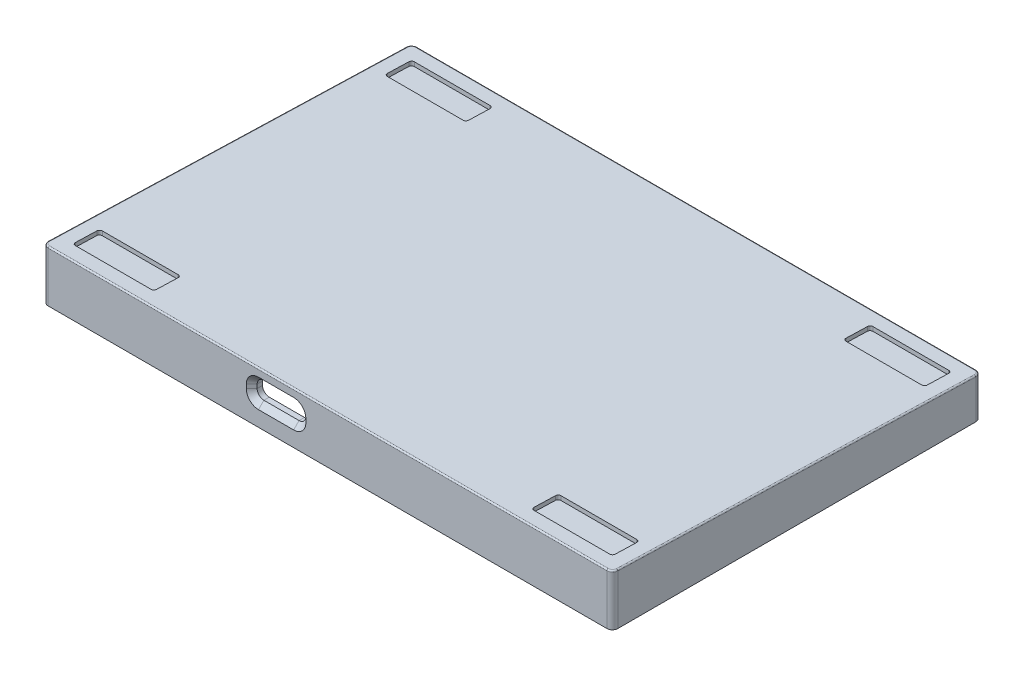
from build123d import *

# Parameters (mm, degrees)
SKETCH1_W           = 105.25
SKETCH1_H           = 68.15
SKETCH1_W_2         = 101.25
SKETCH1_H_2         = 64.15
BOSS_EXTRUDE1_DEPTH = 7.5
CUT_EXTRUDE1_DEPTH  = 125.009414965
BOSS_EXTRUDE5_DEPTH = 105.25
CUT_EXTRUDE2_REACH  = 125.247
CHAMFER1_SIZE       = 1
SKETCH13_RX         = 2.5
SKETCH13_RY         = 2.498833977
BOSS_EXTRUDE7_DEPTH = 10
SKETCH14_W          = 64.15
SKETCH14_H          = 10
CUT_EXTRUDE3_DEPTH  = 45
SKETCH15_R          = 1.5
CUT_EXTRUDE4_DEPTH  = 3
SKETCH15_5_R        = 1.5
CUT_EXTRUDE5_DEPTH  = 4.5
FILLET1_R           = 1
FILLET2_R           = 0.25
CUT_EXTRUDE6_DEPTH  = 0.75


with BuildPart() as part:
    # Sketch1 → Boss-Extrude1 (new body)
    with BuildSketch(Plane(origin=(0, 0, 0), x_dir=(1, 0, 0), z_dir=(0, 1, 0))):
        with Locations((49.625, 31.075)):
            Rectangle(SKETCH1_W, SKETCH1_H)
        with Locations((49.625, 31.075)):
            Rectangle(SKETCH1_W_2, SKETCH1_H_2, mode=Mode.SUBTRACT)
    extrude(amount=BOSS_EXTRUDE1_DEPTH)

    # Sketch4 → Cut-Extrude1 (cut, through all)
    with BuildSketch(Plane.ZY.offset(3)):
        Polygon((-65.15, 7.5), (3, 7.5), (-65.15, 5.417829181), align=None)
    extrude(amount=-CUT_EXTRUDE1_DEPTH, mode=Mode.SUBTRACT)

    # Sketch7 → Boss-Extrude5 (add)
    with BuildSketch(Plane.ZY.offset(3)):
        Polygon((3, 7.5), (3, 9.5), (-65.15, 7.417829181), (-65.15, 5.417829181), align=None)
    extrude(amount=-BOSS_EXTRUDE5_DEPTH)

    # Sketch9 → Cut-Extrude2 (cut, up to next)
    with BuildSketch(Plane.XY.offset(3), mode=Mode.PRIVATE) as cut_extrude2_sk1:
        with BuildLine():
            Line((36.85, 7.04), (43.35, 7.04))
            ThreePointArc((43.35, 7.04), (44.233883476, 6.673883476), (44.6, 5.79))
            Line((44.6, 5.79), (44.6, 5.09))
            ThreePointArc((44.6, 5.09), (44.233883476, 4.206116524), (43.35, 3.84))
            Line((43.35, 3.84), (36.85, 3.84))
            ThreePointArc((36.85, 3.84), (35.966116524, 4.206116524), (35.6, 5.09))
            Line((35.6, 5.09), (35.6, 5.79))
            ThreePointArc((35.6, 5.79), (35.966116524, 6.673883476), (36.85, 7.04))
        make_face()
    cut_extrude2_tool1 = extrude(cut_extrude2_sk1.sketch, amount=-CUT_EXTRUDE2_REACH, mode=Mode.PRIVATE) & part.part
    add(cut_extrude2_tool1.solids().sort_by_distance((40.1, 5.44, 3))[0], mode=Mode.SUBTRACT)

    # Chamfer1
    chamfer1_edges = [part.edges().sort_by_distance(p)[0] for p in [
        (44.233883476, 6.673883476, 3),
        (40.1, 7.04, 3),
        (35.966116524, 6.673883476, 3),
        (35.6, 5.44, 3),
        (35.966116524, 4.206116524, 3),
        (40.1, 3.84, 3),
        (44.233883476, 4.206116524, 3),
        (44.6, 5.44, 3),
    ]]
    chamfer(chamfer1_edges, length=CHAMFER1_SIZE)

    # Sketch13 → Boss-Extrude7 (add)
    with BuildSketch(Plane(origin=(0, 7.401432685, -0.226134221), x_dir=(1, 0, 0), z_dir=(0, -0.9995335908367133, 0.03053851320981564))):
        with Locations(Location((89.25, -9.995335908), (0, 0, 180))):
            Ellipse(SKETCH13_RX, SKETCH13_RY)
        with Locations(Location((74.25, -37.1326729), (0, 0, 180))):
            Ellipse(SKETCH13_RX, SKETCH13_RY)
        with Locations(Location((25, -47.128008808), (0, 0, 180))):
            Ellipse(SKETCH13_RX, SKETCH13_RY)
        with Locations(Location((10, -24.988339771), (0, 0, 180))):
            Ellipse(SKETCH13_RX, SKETCH13_RY)
    extrude(amount=BOSS_EXTRUDE7_DEPTH)

    # Sketch14 → Cut-Extrude3 (cut, symmetric)
    with BuildSketch(Plane.ZY.offset(-49.625)):
        with Locations((-31.075, -1.31)):
            Rectangle(SKETCH14_W, SKETCH14_H)
    extrude(amount=CUT_EXTRUDE3_DEPTH, both=True, mode=Mode.SUBTRACT)

    # Sketch15 → Cut-Extrude4 (cut)
    with BuildSketch(Plane.XZ.offset(-3.69)):
        with Locations(Location((25, -47.262739697, 0), (0, 0, 270))):
            Circle(SKETCH15_R)
        with Locations(Location((74.25, -37.341488102, 0), (0, 0, 270))):
            Circle(SKETCH15_R)
    extrude(amount=-CUT_EXTRUDE4_DEPTH, mode=Mode.SUBTRACT)

    # Sketch15<5> → Cut-Extrude5 (cut)
    with BuildSketch(Plane.XZ.offset(-3.69)):
        with Locations(Location((10, -25.112739697, 0), (0, 0, 270))):
            Circle(SKETCH15_5_R)
        with Locations(Location((89.25, -10.112739697, 0), (0, 0, 270))):
            Circle(SKETCH15_5_R)
    extrude(amount=-CUT_EXTRUDE5_DEPTH, mode=Mode.SUBTRACT)

    # Fillet1
    fillet1_edges = [part.edges().sort_by_distance(p)[0] for p in [
        (-3, 3.708914591, -65.15),
        (102.25, 3.708914591, -65.15),
        (-3, 4.75, 3),
        (102.25, 4.75, 3),
    ]]
    fillet(fillet1_edges, radius=FILLET1_R)

    # Fillet2
    fillet2_edges = [part.edges().sort_by_distance(p)[0] for p in [
        (102.25, 8.458914591, -31.075),
        (49.625, 9.5, 3),
        (49.625, 7.417829181, -65.15),
        (-3, 8.458914591, -31.075),
        (-2.707189246, 9.491048783, 2.707024307),
        (-2.707189246, 7.426780398, -64.857024307),
        (101.957189246, 7.426780398, -64.857024307),
        (101.957189246, 9.491048783, 2.707024307),
    ]]
    fillet(fillet2_edges, radius=FILLET2_R)

    # Sketch16 → Cut-Extrude6 (cut)
    with BuildSketch(Plane(origin=(0, 9.399567483, -0.28718276), x_dir=(1, 0, 0), z_dir=(0, 0.9995335908367133, -0.03053851320981564))):
        with BuildLine():
            Line((99, 57.150605503), (85, 57.150605503))
            ThreePointArc((85, 57.150605503), (84.646446609, 57.297052112), (84.5, 57.650605503))
            Line((84.5, 57.650605503), (84.5, 61.650605503))
            ThreePointArc((84.5, 61.650605503), (84.646446609, 62.004158893), (85, 62.150605503))
            Line((85, 62.150605503), (99, 62.150605503))
            ThreePointArc((99, 62.150605503), (99.353553391, 62.004158893), (99.5, 61.650605503))
            Line((99.5, 61.650605503), (99.5, 57.650605503))
            ThreePointArc((99.5, 57.650605503), (99.353553391, 57.297052112), (99, 57.150605503))
        make_face()
        with BuildLine():
            Line((0.25, 62.150605503), (14.25, 62.150605503))
            ThreePointArc((14.25, 62.150605503), (14.603553391, 62.004158893), (14.75, 61.650605503))
            Line((14.75, 61.650605503), (14.75, 57.650605503))
            ThreePointArc((14.75, 57.650605503), (14.603553391, 57.297052112), (14.25, 57.150605503))
            Line((14.25, 57.150605503), (0.25, 57.150605503))
            ThreePointArc((0.25, 57.150605503), (-0.103553391, 57.297052112), (-0.25, 57.650605503))
            Line((-0.25, 57.650605503), (-0.25, 61.650605503))
            ThreePointArc((-0.25, 61.650605503), (-0.103553391, 62.004158893), (0.25, 62.150605503))
        make_face()
        with BuildLine():
            Line((99.5, -0.0309618), (99.5, 3.9690382))
            ThreePointArc((99.5, 3.9690382), (99.353553391, 4.32259159), (99, 4.4690382))
            Line((99, 4.4690382), (85, 4.4690382))
            ThreePointArc((85, 4.4690382), (84.646446609, 4.32259159), (84.5, 3.9690382))
            Line((84.5, 3.9690382), (84.5, -0.0309618))
            ThreePointArc((84.5, -0.0309618), (84.646446609, -0.384515191), (85, -0.5309618))
            Line((85, -0.5309618), (99, -0.5309618))
            ThreePointArc((99, -0.5309618), (99.353553391, -0.384515191), (99.5, -0.0309618))
        make_face()
        with BuildLine():
            Line((0.25, 4.4690382), (14.25, 4.4690382))
            ThreePointArc((14.25, 4.4690382), (14.603553391, 4.32259159), (14.75, 3.9690382))
            Line((14.75, 3.9690382), (14.75, -0.0309618))
            ThreePointArc((14.75, -0.0309618), (14.603553391, -0.384515191), (14.25, -0.5309618))
            Line((14.25, -0.5309618), (0.25, -0.5309618))
            ThreePointArc((0.25, -0.5309618), (-0.103553391, -0.384515191), (-0.25, -0.0309618))
            Line((-0.25, -0.0309618), (-0.25, 3.9690382))
            ThreePointArc((-0.25, 3.9690382), (-0.103553391, 4.32259159), (0.25, 4.4690382))
        make_face()
    extrude(amount=-CUT_EXTRUDE6_DEPTH, mode=Mode.SUBTRACT)


solid = part.part
